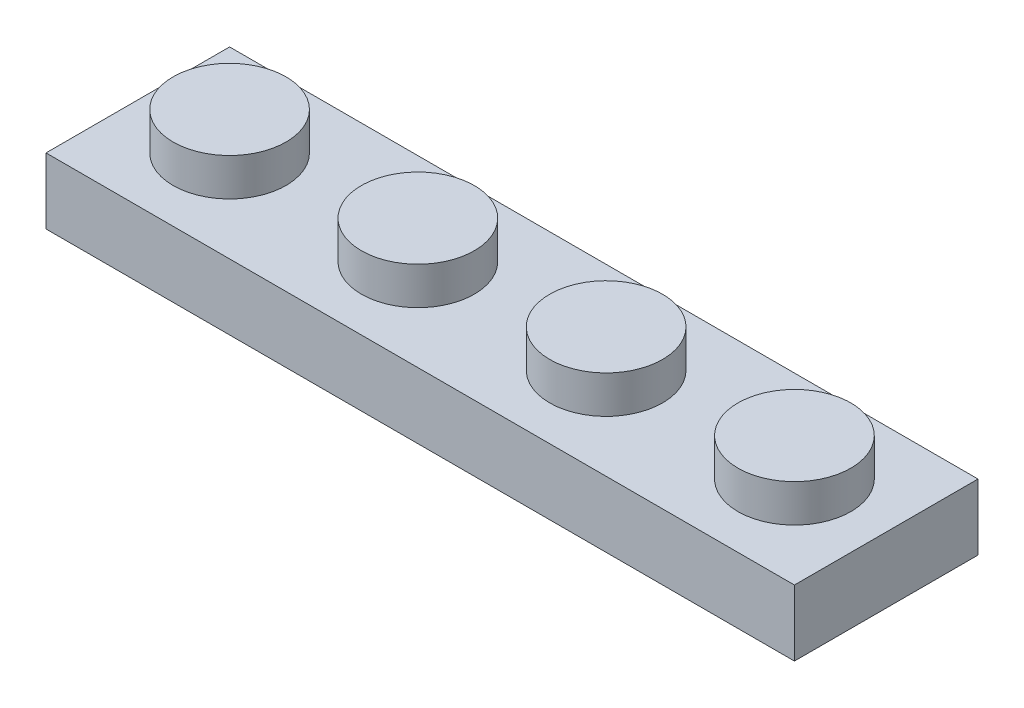
from build123d import *

# Parameters (mm, degrees)
SKETCH1_W            = 31.8
SKETCH1_H            = 2.8
BOSS_EXTRUDE1_DEPTH  = 7.8
SKETCH2_R            = 2.4
BOSS_EXTRUDE2_DEPTH  = 1.6
LPATTERN1_COUNT      = 2
LPATTERN1_PITCH      = 8
LPATTERN1_COUNT_DIR2 = 4
LPATTERN1_PITCH_DIR2 = 8
SHELL1_T             = -0.5
SKETCH3_R            = 1.15
SKETCH3_R_2          = 0.5
BOSS_EXTRUDE3_DEPTH  = 2.1
LPATTERN2_COUNT      = 3
LPATTERN2_PITCH      = 8


with BuildPart() as part:
    # Sketch1 → Boss-Extrude1 (new body)
    with BuildSketch(Plane.XY):
        with Locations((15.9, 1.4)):
            Rectangle(SKETCH1_W, SKETCH1_H)
    extrude(amount=-BOSS_EXTRUDE1_DEPTH)

    # Sketch2 → Boss-Extrude2 (add)
    with BuildSketch(Plane(origin=(0, 2.8, 0), x_dir=(1, 0, 0), z_dir=(0, 1, 0))):
        with Locations(Location((3.9, 3.9, 0), (0, 0, 270))):
            Circle(SKETCH2_R)
    boss_extrude2 = extrude(amount=BOSS_EXTRUDE2_DEPTH)

    # LPattern1: Boss-Extrude2 2 × 4, 4 skipped
    with Locations(*[(j * LPATTERN1_PITCH_DIR2, 0, i * LPATTERN1_PITCH) for i in range(LPATTERN1_COUNT) for j in range(LPATTERN1_COUNT_DIR2) if (i, j) not in ((0, 0), (1, 0), (1, 1), (1, 2), (1, 3))]):
        add(boss_extrude2)

    # Shell1
    shell1_openings = [part.faces().sort_by_distance(p)[0] for p in [
        (15.9, 0, -3.9),
    ]]
    offset(amount=SHELL1_T, openings=shell1_openings, kind=Kind.INTERSECTION)

    # Sketch3 → Boss-Extrude3 (add)
    with BuildSketch(Plane.XZ.offset(-2.3)):
        with Locations(Location((7.9, -3.9, 0), (0, 0, 90))):
            Circle(SKETCH3_R)
        with Locations(Location((7.9, -3.9, 0), (0, 0, 270))):
            Circle(SKETCH3_R_2, mode=Mode.SUBTRACT)
    boss_extrude3 = extrude(amount=BOSS_EXTRUDE3_DEPTH)

    # LPattern2: Boss-Extrude3 ×3
    with Locations(*[(i * LPATTERN2_PITCH, 0, 0) for i in range(1, LPATTERN2_COUNT)]):
        add(boss_extrude3)


solid = part.part
